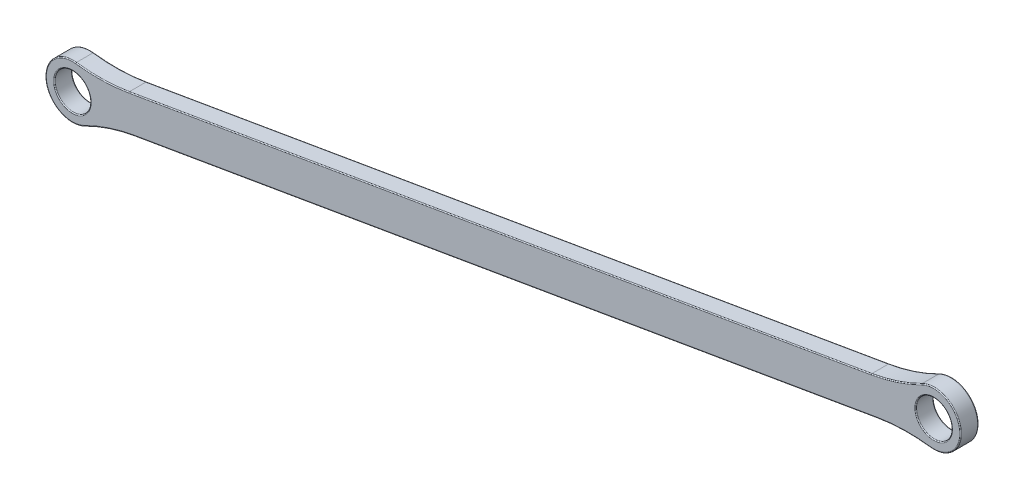
from build123d import *

# Parameters (mm, degrees)
BOSS_EXTRUDE1_DEPTH = 3
FILLET2_R           = 30
FILLET3_R           = 0.15


with BuildPart() as part:
    # Sketch1 → Boss-Extrude1 (new body)
    with BuildSketch(Plane.XY):
        with BuildLine():
            Line((-104.206592416, 224.976766634), (-241.500153346, 201.467564632))
            ThreePointArc((-241.500153346, 201.467564632), (-240.24712741, 199.900466655), (-239.799808514, 197.944507587))
            ThreePointArc((-239.799808514, 197.944507587), (-239.975145656, 196.700605997), (-240.487493477, 195.553638695))
            Line((-240.487493477, 195.553638695), (-103.193932546, 219.062840697))
            ThreePointArc((-103.193932546, 219.062840697), (-104.829721832, 221.82640284), (-104.206592416, 224.976766634))
        make_face()
        with BuildLine():
            ThreePointArc((-243.793478579, 194.987544619), (-247.256771482, 197.438177653), (-244.806138448, 200.901470556))
            Line((-244.806138448, 200.901470556), (-241.500153346, 201.467564632))
            ThreePointArc((-241.500153346, 201.467564632), (-248.735252967, 197.185012685), (-240.487493477, 195.553638695))
            Line((-240.487493477, 195.553638695), (-243.793478579, 194.987544619))
        make_face()
        with BuildLine():
            Line((-241.500153346, 201.467564632), (-244.806138448, 200.901470556))
            ThreePointArc((-244.806138448, 200.901470556), (-241.342845545, 198.450837522), (-243.793478579, 194.987544619))
            Line((-243.793478579, 194.987544619), (-240.487493477, 195.553638695))
            ThreePointArc((-240.487493477, 195.553638695), (-239.975145656, 196.700605997), (-239.799808514, 197.944507587))
            ThreePointArc((-239.799808514, 197.944507587), (-240.24712741, 199.900466655), (-241.500153346, 201.467564632))
        make_face()
        with BuildLine():
            ThreePointArc((-95.894277379, 222.585897742), (-99.150375788, 226.910560599), (-104.206592416, 224.976766634))
            Line((-104.206592416, 224.976766634), (-100.900607313, 225.54286071))
            ThreePointArc((-100.900607313, 225.54286071), (-97.43731441, 223.092227676), (-99.887947444, 219.628934773))
            Line((-99.887947444, 219.628934773), (-103.193932546, 219.062840697))
            ThreePointArc((-103.193932546, 219.062840697), (-98.438318311, 218.533216638), (-95.894277379, 222.585897742))
        make_face()
        with BuildLine():
            Line((-100.900607313, 225.54286071), (-104.206592416, 224.976766634))
            ThreePointArc((-104.206592416, 224.976766634), (-104.829721832, 221.82640284), (-103.193932546, 219.062840697))
            Line((-103.193932546, 219.062840697), (-99.887947444, 219.628934773))
            ThreePointArc((-99.887947444, 219.628934773), (-103.351240347, 222.079567807), (-100.900607313, 225.54286071))
        make_face()
    extrude(amount=-BOSS_EXTRUDE1_DEPTH)

    # Fillet2
    fillet2_edges = [part.edges().sort_by_distance(p)[0] for p in [
        (-241.500153346, 201.467564632, -1.5),
        (-104.206592416, 224.976766634, -1.5),
        (-103.193932546, 219.062840697, -1.5),
        (-240.487493477, 195.553638695, -1.5),
    ]]
    fillet(fillet2_edges, radius=FILLET2_R)

    # Fillet3
    fillet3_edges = [part.edges().sort_by_distance(p)[0] for p in [
        (-100.900607313, 225.54286071, 0),
        (-248.735252967, 197.185012685, 0),
        (-248.735252967, 197.185012685, -3),
        (-171.840713012, 207.308239696, 0),
        (-171.840713012, 207.308239696, -3),
        (-95.958832926, 223.345392644, 0),
        (-95.958832926, 223.345392644, -3),
        (-172.853372881, 213.222165633, 0),
        (-172.853372881, 213.222165633, -3),
        (-244.806138448, 200.901470556, -3),
        (-238.179989049, 195.616109033, 0),
        (-238.179989049, 195.616109033, -3),
        (-105.390760441, 218.354020249, 0),
        (-105.390760441, 218.354020249, -3),
        (-106.514096843, 224.914296296, 0),
        (-106.514096843, 224.914296296, -3),
        (-239.303325452, 202.17638508, 0),
        (-239.303325452, 202.17638508, -3),
        (-100.900607313, 225.54286071, -3),
        (-244.806138448, 200.901470556, 0),
    ]]
    fillet(fillet3_edges, radius=FILLET3_R)


solid = part.part
